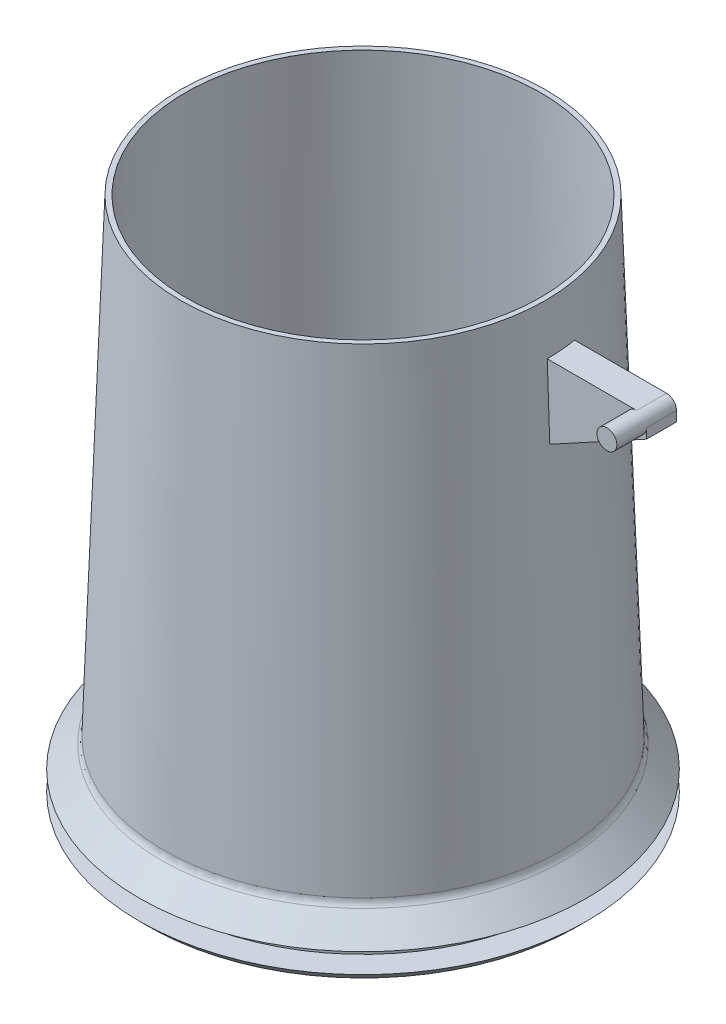
from build123d import *

# Parameters (mm, degrees)
BOSS_EXTRUDE1_DEPTH = 3
BOSS_EXTRUDE2_START = 3
BOSS_EXTRUDE2_DEPTH = 3


with BuildPart() as part:
    # Sketch1 → Revolve1 (revolve)
    with BuildSketch(Plane.XY):
        with BuildLine():
            Line((19.706224116, -3), (21.5, -3))
            Line((21.5, -3), (22.5, -2))
            Line((22.5, -2), (20, -2))
            Line((20, -2), (20, 0))
            Line((20, 0), (22.5, 0))
            Line((22.5, 0), (20.292893219, 2.207106781))
            ThreePointArc((20.292893219, 2.207106781), (20.076120467, 2.53153013), (20, 2.914213562))
            Line((20, 2.914213562), (18.355728105, 50))
            Line((18.355728105, 50), (17.856032692, 50))
            Line((17.856032692, 50), (17.856032692, 49.982550252))
            Line((17.856032692, 49.982550252), (19.500030777, 2.904604688))
            Line((19.500030777, 2.904604688), (19.706224116, -3))
        make_face()
    revolve(axis=Axis((0, 0, 0), (0, 1, 0)))

    # Sketch2 → Boss-Extrude1 (add)
    with BuildSketch(Plane.XY):
        with BuildLine():
            Line((18.285809554, 37.684078697), (18.785809554, 37.684078697))
            Line((18.785809554, 37.684078697), (28.530331953, 43))
            Line((28.530331953, 43), (28.530331953, 44))
            ThreePointArc((28.530331953, 44), (28.237438734, 44.707106781), (27.530331953, 45))
            Line((27.530331953, 45), (18.285809554, 45))
            Line((18.285809554, 45), (18.285809554, 37.684078697))
        make_face()
    extrude(amount=-BOSS_EXTRUDE1_DEPTH)

    # Sketch2<3> → Boss-Extrude2 (add)
    with BuildSketch(Plane.XY.offset(BOSS_EXTRUDE2_START)):
        with BuildLine():
            ThreePointArc((27.530331953, 45), (26.823225172, 43.292893219), (28.530331953, 44))
            ThreePointArc((28.530331953, 44), (28.237438734, 44.707106781), (27.530331953, 45))
        make_face()
    extrude(amount=-BOSS_EXTRUDE2_DEPTH)


solid = part.part
